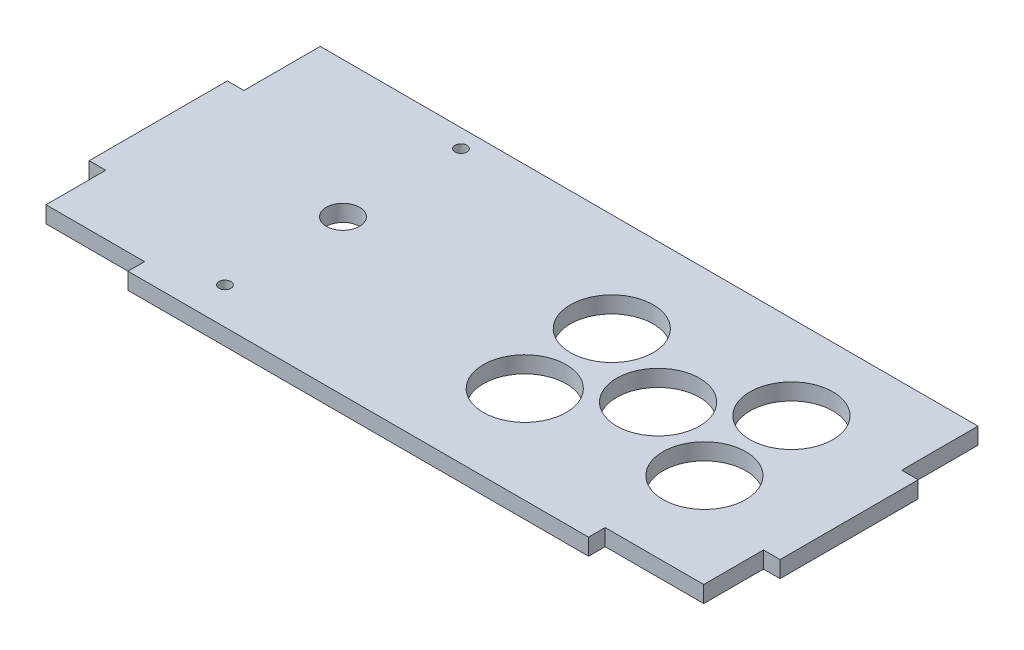
from build123d import *

# Parameters (mm, degrees)
SKETCH1_W              = 500
SKETCH1_H              = 210.49
BOSS_EXTRUDE1_DEPTH    = 12
SKETCH2_W              = 83.333333333
SKETCH2_H              = 12
SKETCH2_W_2            = 12
CUT_EXTRUDE1_DEPTH     = 543.632509255
SKETCH3_W              = 12
SKETCH3_H              = 43.245
CUT_EXTRUDE2_DEPTH     = 543.632509255
SCALE1_SCALE           = 0.5
F_12_0MM_DOWEL_SLOT1_D = 12
M4_CLEARANCE_SLOT1_D   = 4.3
F_1_0MM_DOWEL_SLOT1_D  = 30


with BuildPart() as part:
    # Sketch1 → Boss-Extrude1 (new body)
    with BuildSketch(Plane(origin=(0, 0, 0), x_dir=(1, 0, 0), z_dir=(0, 1, 0))):
        with Locations((250, 105.245)):
            Rectangle(SKETCH1_W, SKETCH1_H)
    extrude(amount=BOSS_EXTRUDE1_DEPTH)

    # Sketch2 → Cut-Extrude1 (cut, through all)
    with BuildSketch(Plane(origin=(0, 12, 0), x_dir=(1, 0, 0), z_dir=(0, 1, 0))):
        with Locations((458.333333334, 6)):
            Rectangle(SKETCH2_W, SKETCH2_H)
        with Locations((494, 204.49)):
            Rectangle(SKETCH2_W_2, SKETCH2_H)
        with Locations((6, 204.49)):
            Rectangle(SKETCH2_W_2, SKETCH2_H)
        with Locations((41.666666666, 6)):
            Rectangle(SKETCH2_W, SKETCH2_H)
    extrude(amount=-CUT_EXTRUDE1_DEPTH, mode=Mode.SUBTRACT)

    # Sketch3 → Cut-Extrude2 (cut, through all)
    with BuildSketch(Plane(origin=(0, 12, 0), x_dir=(1, 0, 0), z_dir=(0, 1, 0))):
        with Locations((494, 33.6225)):
            Rectangle(SKETCH3_W, SKETCH3_H)
        with Locations((494, 176.8675)):
            Rectangle(SKETCH3_W, SKETCH3_H)
        with Locations((6, 176.8675)):
            Rectangle(SKETCH3_W, SKETCH3_H)
        with Locations((6, 33.6225)):
            Rectangle(SKETCH3_W, SKETCH3_H)
    extrude(amount=-CUT_EXTRUDE2_DEPTH, mode=Mode.SUBTRACT)


with BuildPart() as part_1:
    # Scale1: scaled about (250, 6, -106.929232272)
    add(part.part.scale(SCALE1_SCALE).moved(Location((125, 3, -53.464616136))))

    # Ø12.0mm Dowel Slot1 (through all)
    with Locations(Plane(origin=(0, 9, 0), x_dir=(1, 0, 0), z_dir=(0, 1, 0))):
        with Locations((188.5, 109.409616136)):
            Hole(F_12_0MM_DOWEL_SLOT1_D / 2)

    # M4 Clearance Slot1 (through all)
    with Locations(Plane(origin=(0, 3, 0), x_dir=(-1, 0, 0), z_dir=(0, -1, 0))):
        with Locations((-188.5, 152.109616136), (-188.5, 66.709616136)):
            Hole(M4_CLEARANCE_SLOT1_D / 2)

    # Ø1.0mm Dowel Slot1 (through all)
    with Locations(Plane(origin=(0, 9, 0), x_dir=(1, 0, 0), z_dir=(0, 1, 0))):
        with Locations((275.228318114, 88.480271571), (335, 93.709616136), (303.604577311, 108.349542167), (272.209154622, 122.989468197), (331.980836508, 128.218812762)):
            Hole(F_1_0MM_DOWEL_SLOT1_D / 2)


solid = part_1.part
